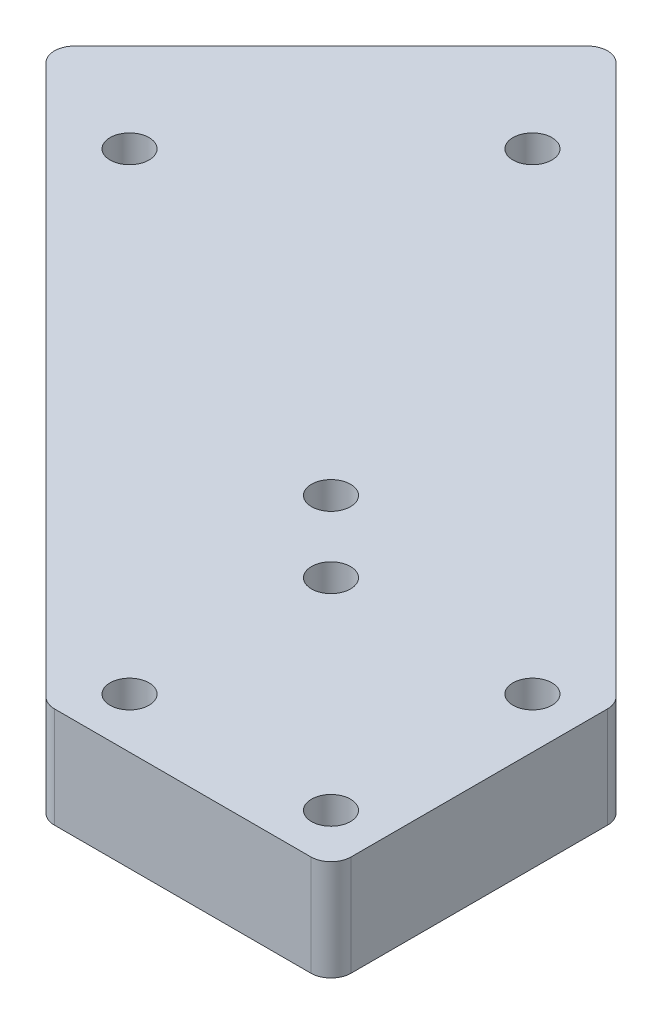
from build123d import *

# Parameters (mm, degrees)
SKETCH3_W             = 35.921024484
SKETCH3_H             = 35.921024484
BOSS_EXTRUDE2_DEPTH   = 12.7
BOSS_EXTRUDE3_DEPTH   = 25.4
F_8_CLEARANCE_HOLE1_D = 4.9149
F_8_CLEARANCE_HOLE2_D = 4.9149
FILLET1_R             = 2.54


with BuildPart() as part:
    # Sketch3 → Boss-Extrude2 (new body)
    with BuildSketch(Plane(origin=(0, 0, 0), x_dir=(1, 0, 0), z_dir=(0, 1, 0))):
        with Locations((17.960512242, -17.960512242)):
            Rectangle(SKETCH3_W, SKETCH3_H)
    extrude(amount=BOSS_EXTRUDE2_DEPTH)

    # Sketch4 → Boss-Extrude3 (add, symmetric)
    with BuildSketch(Plane(origin=(0, 0, 0), x_dir=(0.7071067811865476, 0, 0.7071067811865475), z_dir=(-0.7071067811865475, 0, 0.7071067811865476))):
        Polygon((25.4, 12.7), (-50.8, 12.7), (-76.2, 12.7), (-76.2, 0), (0, 0), (25.4, 0), align=None)
    extrude(amount=BOSS_EXTRUDE3_DEPTH, both=True)

    # #8 Clearance Hole1 (through all)
    with Locations(Plane(origin=(0, 0, 0), x_dir=(-1, 0, 0), z_dir=(0, -1, 0))):
        with Locations((-29.571024484, -29.571024484), (-4.171024484, -4.171024484), (-29.571024484, -4.171024484), (-4.171024484, -29.571024484), (4.809231637, 4.809231637)):
            Hole(F_8_CLEARANCE_HOLE1_D / 2)

    # #8 Clearance Hole2 (through all)
    with Locations(Plane(origin=(0, 12.7, 0), x_dir=(1, 0, 0), z_dir=(0, 1, 0))):
        with Locations((-55.35429873, 29.95813442), (-29.95813442, 55.35429873)):
            Hole(F_8_CLEARANCE_HOLE2_D / 2)

    # Fillet1
    fillet1_edges = [part.edges().sort_by_distance(p)[0] for p in [
        (-35.921024484, 6.35, -71.842048969),
        (-71.842048969, 6.35, -35.921024484),
        (35.921024484, 6.35, 0),
        (35.921024484, 6.35, 35.921024484),
        (0, 6.35, 35.921024484),
    ]]
    fillet(fillet1_edges, radius=FILLET1_R)


solid = part.part
